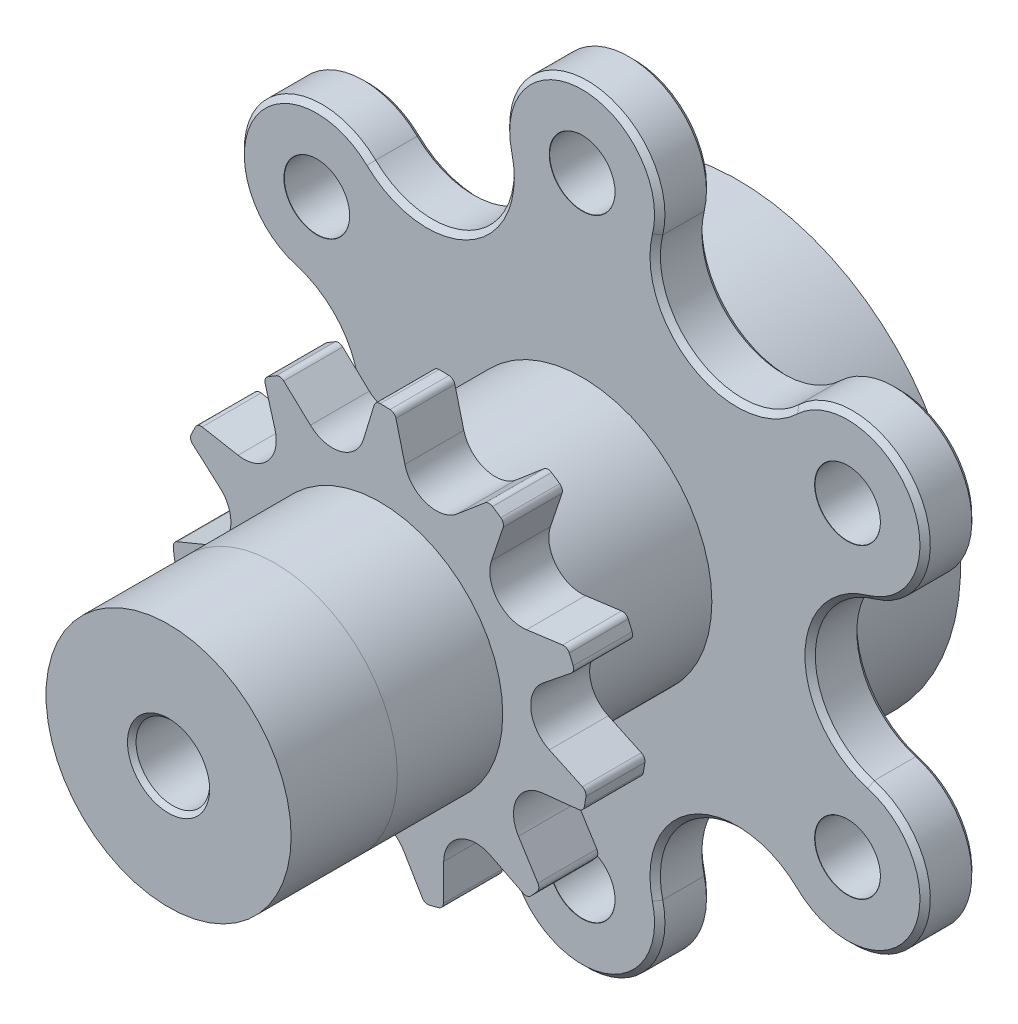
from build123d import *

# Parameters (mm, degrees)
SKETCH1_R                        = 47
BOSS_EXTRUDE1_DEPTH              = 6.35
F_8_0MM_DOWEL_HOLE1_D            = 8
F_8_0MM_DOWEL_HOLE1_CSINK_D      = 8.05
F_8_0MM_DOWEL_HOLE1_CSINK_ANGLE  = 90
CIRPATTERN1_COUNT                = 6
CUT_EXTRUDE1_DEPTH               = 67.770670957
CHAMFER1_SIZE                    = 0.635
SKETCH20_R                       = 27.265
SKETCH20_R_2                     = 23.455
BOSS_EXTRUDE5_DEPTH              = 12.7
SKETCH21_R                       = 15.875
BOSS_EXTRUDE6_DEPTH              = 17.5
SKETCH22_R                       = 27.5082
BOSS_EXTRUDE7_DEPTH              = 7.2136
CUT_EXTRUDE4_START               = -7.62
SKETCH25_R                       = 27.5082
CUT_EXTRUDE4_DEPTH               = 7.62
CIRPATTERN2_COUNT                = 11
SKETCH23_R                       = 15
BOSS_EXTRUDE8_DEPTH              = 25.899999848
M10X1_0_TAPPED_HOLE1_D           = 9
M10X1_0_TAPPED_HOLE1_CSINK_D     = 10.05
M10X1_0_TAPPED_HOLE1_CSINK_ANGLE = 90


with BuildPart() as part:
    # Sketch1 → Boss-Extrude1 (new body)
    with BuildSketch(Plane.XY):
        Circle(SKETCH1_R)
    extrude(amount=BOSS_EXTRUDE1_DEPTH)

    # Ø8.0mm Dowel Hole1 (through all)
    with Locations(Plane.XY.offset(6.35)):
        with Locations((0, -37.5)):
            f_8_0mm_dowel_hole1 = CounterSinkHole(F_8_0MM_DOWEL_HOLE1_D / 2, F_8_0MM_DOWEL_HOLE1_CSINK_D / 2, counter_sink_angle=F_8_0MM_DOWEL_HOLE1_CSINK_ANGLE)

    # CirPattern1: Ø8.0mm Dowel Hole1 ×6 about axis
    cirpattern1_axis = Axis((0, 0, 0), (0, 0, 1))
    for i in range(1, CIRPATTERN1_COUNT):
        add(f_8_0mm_dowel_hole1.rotate(cirpattern1_axis, i * 360 / CIRPATTERN1_COUNT), mode=Mode.SUBTRACT)

    # Sketch5 → Cut-Extrude1 (cut, through all)
    with BuildSketch(Plane.XY.offset(6.35)):
        with BuildLine():
            ThreePointArc((-9.226076329, 35.235156614), (-7.475493707, 43.362336892), (-1.8e-08, 47))
            ThreePointArc((-1.8e-08, 47), (-23.500000014, 40.70319397), (-40.703193985, 23.499999988))
            ThreePointArc((-40.703193985, 23.499999988), (-33.815138478, 28.1551359), (-25.901502569, 25.607594786))
            ThreePointArc((-25.901502569, 25.607594786), (-13.95, 24.162108766), (-9.226076329, 35.235156614))
        make_face()
        with BuildLine():
            ThreePointArc((25.901502569, 25.607594786), (33.815138801, 28.155135854), (40.703194311, 23.499999422))
            ThreePointArc((40.703194311, 23.499999422), (23.500000281, 40.703193816), (-1.8e-08, 47))
            ThreePointArc((-1.8e-08, 47), (7.475493696, 43.362336906), (9.226076329, 35.235156614))
            ThreePointArc((9.226076329, 35.235156614), (13.95, 24.162108766), (25.901502569, 25.607594786))
        make_face()
        with BuildLine():
            ThreePointArc((-35.127578899, 9.627561828), (-41.29063217, 15.207200992), (-40.703193985, 23.499999988))
            ThreePointArc((-40.703193985, 23.499999988), (-47, 9.11e-07), (-40.703194896, -23.49999841))
            ThreePointArc((-40.703194896, -23.49999841), (-41.29063183, -15.207200146), (-35.127578899, -9.627561828))
            ThreePointArc((-35.127578899, -9.627561828), (-27.9, 0), (-35.127578899, 9.627561828))
        make_face()
        with BuildLine():
            ThreePointArc((-40.703194896, -23.49999841), (-23.500000869, -40.703193476), (-1.71e-07, -47))
            ThreePointArc((-1.71e-07, -47), (-7.475493754, -43.362336832), (-9.226076329, -35.235156614))
            ThreePointArc((-9.226076329, -35.235156614), (-13.95, -24.162108766), (-25.901502569, -25.607594786))
            ThreePointArc((-25.901502569, -25.607594786), (-33.81513938, -28.155135771), (-40.703194896, -23.49999841))
        make_face()
        with BuildLine():
            ThreePointArc((-1.71e-07, -47), (23.500002394, -40.703192596), (40.703196828, -23.499995063))
            ThreePointArc((40.703196828, -23.499995063), (33.815141293, -28.155135499), (25.901502569, -25.607594786))
            ThreePointArc((25.901502569, -25.607594786), (13.95, -24.162108766), (9.226076329, -35.235156614))
            ThreePointArc((9.226076329, -35.235156614), (7.475493649, -43.362336966), (-1.71e-07, -47))
        make_face()
        with BuildLine():
            ThreePointArc((40.703196828, -23.499995063), (45.398514573, -12.164492367), (47, 0))
            ThreePointArc((47, 0), (45.398513922, 12.164494798), (40.703194311, 23.499999422))
            ThreePointArc((40.703194311, 23.499999422), (41.290632048, 15.207200689), (35.127578899, 9.627561828))
            ThreePointArc((35.127578899, 9.627561828), (27.9, 0), (35.127578899, -9.627561828))
            ThreePointArc((35.127578899, -9.627561828), (41.29063111, -15.207198354), (40.703196828, -23.499995063))
        make_face()
    extrude(amount=-CUT_EXTRUDE1_DEPTH, mode=Mode.SUBTRACT)

    # Chamfer1
    chamfer1_edges = [part.edges().sort_by_distance(p)[0] for p in [
        (13.95, -24.162108766, 0),
        (13.95, -24.162108766, 6.35),
        (-40.703193978, 23.5, 6.35),
        (0, 47, 0),
        (-13.95, 24.162108766, 0),
        (-40.703193978, 23.5, 0),
        (-13.95, 24.162108766, 6.35),
        (0, 47, 6.35),
        (0, -47, 6.35),
        (-40.703193978, -23.5, 6.35),
        (-13.95, -24.162108766, 0),
        (0, -47, 0),
        (-40.703193978, -23.5, 0),
        (-13.95, -24.162108766, 6.35),
        (40.703193978, -23.5, 6.35),
        (27.9, 0, 0),
        (40.703193978, 23.5, 0),
        (40.703193978, -23.5, 0),
        (40.703193978, 23.5, 6.35),
        (27.9, 0, 6.35),
        (13.95, 24.162108766, 0),
        (13.95, 24.162108766, 6.35),
        (-27.9, 0, 0),
        (-27.9, 0, 6.35),
    ]]
    chamfer(chamfer1_edges, length=CHAMFER1_SIZE)

    # Sketch20 → Boss-Extrude5 (add)
    with BuildSketch(Plane(origin=(0, 0, 0), x_dir=(-1, 0, 0), z_dir=(0, 0, -1))):
        Circle(SKETCH20_R)
        Circle(SKETCH20_R_2, mode=Mode.SUBTRACT)
    extrude(amount=BOSS_EXTRUDE5_DEPTH)

    # Sketch21 → Boss-Extrude6 (add)
    with BuildSketch(Plane.XY.offset(6.35)):
        Circle(SKETCH21_R)
    extrude(amount=BOSS_EXTRUDE6_DEPTH)

    # Sketch22 → Boss-Extrude7 (add)
    with BuildSketch(Plane.XY.offset(23.85)):
        Circle(SKETCH22_R)
    extrude(amount=BOSS_EXTRUDE7_DEPTH)

    # Sketch25 → Cut-Extrude4 (cut)
    with BuildSketch(Plane.XY.offset(31.0636).offset(CUT_EXTRUDE4_START)):
        Circle(SKETCH25_R)
        with BuildLine():
            Line((-2.044057429, 20.61952267), (-0.743775253, 24.887183314))
            ThreePointArc((-0.743775253, 24.887183314), (-0.462793372, 25.285370639), (0, 25.4381))
            ThreePointArc((0, 25.4381), (6.583864751, -24.571317762), (-12.71905, 22.030040824))
            ThreePointArc((-12.71905, 22.030040824), (-12.241894502, 22.129170004), (-11.799463393, 21.924820605))
            Line((-11.799463393, 21.924820605), (-8.539555675, 18.879059161))
            ThreePointArc((-8.539555675, 18.879059161), (-4.80888374, 17.946998445), (-2.044057429, 20.61952267))
        make_face(mode=Mode.SUBTRACT)
    cut_extrude4 = extrude(amount=CUT_EXTRUDE4_DEPTH, mode=Mode.SUBTRACT)

    # CirPattern2: Cut-Extrude4 ×11 about axis
    cirpattern2_axis = Axis((0, 0, 0), (0, 0, 1))
    for i in range(1, CIRPATTERN2_COUNT):
        add(cut_extrude4.rotate(cirpattern2_axis, i * 360 / CIRPATTERN2_COUNT), mode=Mode.SUBTRACT)

    # Sketch23 → Boss-Extrude8 (add)
    with BuildSketch(Plane.XY.offset(31.0636)):
        Circle(SKETCH23_R)
    extrude(amount=BOSS_EXTRUDE8_DEPTH)

    # M10x1.0 Tapped Hole1 (through all)
    with Locations(Plane.XY.offset(56.963599848)):
        with Locations((0, 0)):
            CounterSinkHole(M10X1_0_TAPPED_HOLE1_D / 2, M10X1_0_TAPPED_HOLE1_CSINK_D / 2, counter_sink_angle=M10X1_0_TAPPED_HOLE1_CSINK_ANGLE)


solid = part.part
